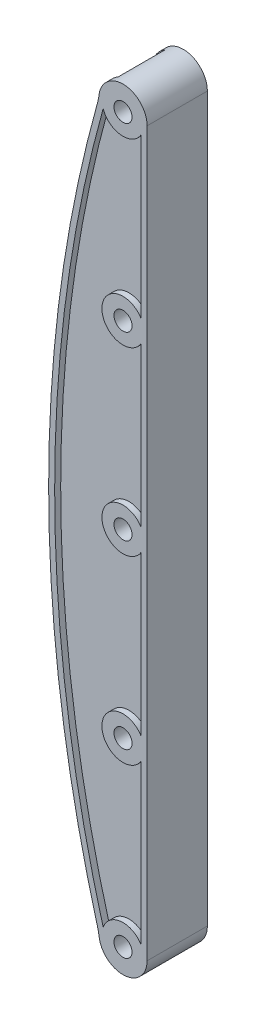
from build123d import *

# Parameters (mm, degrees)
SKETCH1_R           = 1.5
BOSS_EXTRUDE1_DEPTH = 5
FILLET1_R           = 10
CUT_EXTRUDE1_DEPTH  = 1
CUT_EXTRUDE2_DEPTH  = 3.9


with BuildPart() as part:
    # Sketch1 → Boss-Extrude1 (new, symmetric)
    with BuildSketch(Plane.XY):
        with BuildLine():
            Line((4, 60), (4, -60))
            ThreePointArc((4, -60), (0, -64), (-4, -60))
            ThreePointArc((-4, -60), (-12.339895115, 0), (-4, 60))
            ThreePointArc((-4, 60), (0, 64), (4, 60))
        make_face()
        with Locations((0, 60)):
            Circle(SKETCH1_R, mode=Mode.SUBTRACT)
        with Locations((0, 30)):
            Circle(SKETCH1_R, mode=Mode.SUBTRACT)
        with Locations((0, -30)):
            Circle(SKETCH1_R, mode=Mode.SUBTRACT)
        Circle(SKETCH1_R, mode=Mode.SUBTRACT)
        with Locations((0, -60)):
            Circle(SKETCH1_R, mode=Mode.SUBTRACT)
    extrude(amount=BOSS_EXTRUDE1_DEPTH, both=True)

    # Fillet1
    fillet1_edges = [part.edges().sort_by_distance(p)[0] for p in [
        (-4, -60, 0),
        (-4, 60, 0),
    ]]
    fillet(fillet1_edges, radius=FILLET1_R)

    # Sketch2 → Cut-Extrude1 (cut)
    with BuildSketch(Plane.XY.offset(5)):
        with BuildLine():
            ThreePointArc((-3.293906421, -58.816707776), (-0.342834029, -56.516831209), (3, -58.197224362))
            Line((3, -58.197224362), (3, -31.802775638))
            ThreePointArc((3, -31.802775638), (-3.5, -30), (3, -28.197224362))
            Line((3, -28.197224362), (3, -1.802775638))
            ThreePointArc((3, -1.802775638), (-3.5, 0), (3, 1.802775638))
            Line((3, 1.802775638), (3, 28.197224362))
            ThreePointArc((3, 28.197224362), (-3.5, 30), (3, 31.802775638))
            Line((3, 31.802775638), (3, 58.197224362))
            ThreePointArc((3, 58.197224362), (-0.342834029, 56.516831209), (-3.293906421, 58.816707776))
            ThreePointArc((-3.293906421, 58.816707776), (-11.339895115, 0), (-3.293906421, -58.816707776))
        make_face()
    extrude(amount=-CUT_EXTRUDE1_DEPTH, mode=Mode.SUBTRACT)

    # Sketch3 → Cut-Extrude2 (cut, symmetric)
    with BuildSketch(Plane.XY):
        with BuildLine():
            ThreePointArc((-3.293906421, 58.816707776), (-1.64732722, 64.431350021), (0.148659418, 70))
            Line((0.148659418, 70), (-49.851340582, 70))
            Line((-49.851340582, 70), (-49.851340582, -70))
            Line((-49.851340582, -70), (0.148659418, -70))
            ThreePointArc((0.148659418, -70), (-1.64732722, -64.431350021), (-3.293906421, -58.816707776))
            ThreePointArc((-3.293906421, -58.816707776), (-11.339895115, 0), (-3.293906421, 58.816707776))
        make_face()
    extrude(amount=CUT_EXTRUDE2_DEPTH, both=True, mode=Mode.SUBTRACT)


solid = part.part
